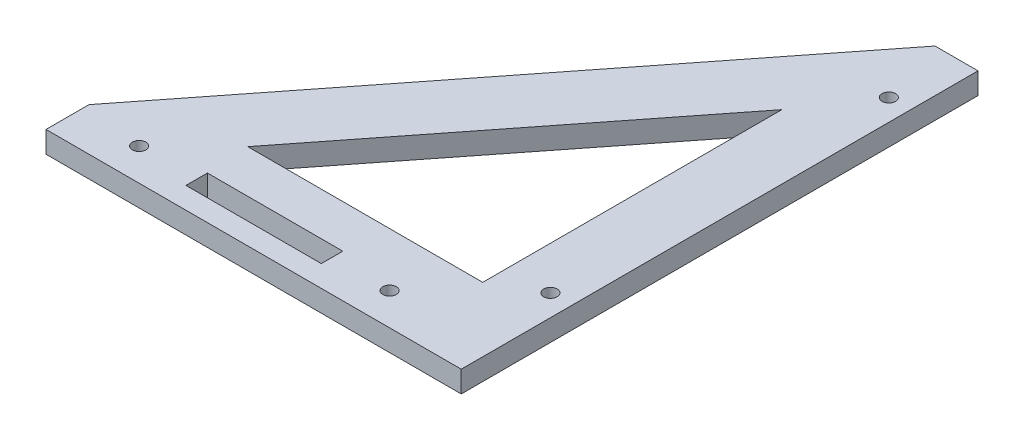
from build123d import *

# Parameters (mm, degrees)
BOSS_EXTRUDE1_DEPTH = 3.175
SKETCH3_W           = 55
SKETCH3_H           = 6.35
BOSS_EXTRUDE3_DEPTH = 3.175
SKETCH5_W           = 6.35
SKETCH5_H           = 76.35
BOSS_EXTRUDE4_DEPTH = 3.175
SKETCH2_R           = 1
SKETCH2_W           = 20
SKETCH2_H           = 3.175
CUT_EXTRUDE1_DEPTH  = 3.175
CUT_EXTRUDE2_DEPTH  = 3.175


with BuildPart() as part:
    # Sketch1 → Boss-Extrude1 (new body)
    with BuildSketch(Plane(origin=(0, 0, 0), x_dir=(1, 0, 0), z_dir=(0, 1, 0))):
        Polygon((0, 0), (55, 0), (55, 70), align=None)
    extrude(amount=BOSS_EXTRUDE1_DEPTH)

    # Sketch3 → Boss-Extrude3 (add)
    with BuildSketch(Plane.XZ):
        with Locations((27.5, 3.175)):
            Rectangle(SKETCH3_W, SKETCH3_H)
    extrude(amount=-BOSS_EXTRUDE3_DEPTH)

    # Sketch5 → Boss-Extrude4 (add)
    with BuildSketch(Plane.XZ):
        with Locations((58.175, -31.825)):
            Rectangle(SKETCH5_W, SKETCH5_H)
    extrude(amount=-BOSS_EXTRUDE4_DEPTH)

    # Sketch2 → Cut-Extrude1 (cut)
    with BuildSketch(Plane(origin=(0, 3.175, 0), x_dir=(1, 0, 0), z_dir=(0, 1, 0))):
        with Locations(Location((9, -1.5875, 0), (0, 0, 270))):
            Circle(SKETCH2_R)
        with Locations(Location((46, -1.5875, 0), (0, 0, 270))):
            Circle(SKETCH2_R)
        with Locations(Location((58.175, 60, 0), (0, 0, 270))):
            Circle(SKETCH2_R)
        with Locations(Location((58.175, 10, 0), (0, 0, 270))):
            Circle(SKETCH2_R)
        with Locations((27.5, -1.5875)):
            Rectangle(SKETCH2_W, SKETCH2_H)
    extrude(amount=-CUT_EXTRUDE1_DEPTH, mode=Mode.SUBTRACT)

    # Sketch6 → Cut-Extrude2 (cut)
    with BuildSketch(Plane(origin=(0, 3.175, 0), x_dir=(1, 0, 0), z_dir=(0, 1, 0))):
        Polygon((51.825, 6.35), (17.102700256, 6.35), (51.825, 50.542017856), align=None)
    extrude(amount=-CUT_EXTRUDE2_DEPTH, mode=Mode.SUBTRACT)


solid = part.part
